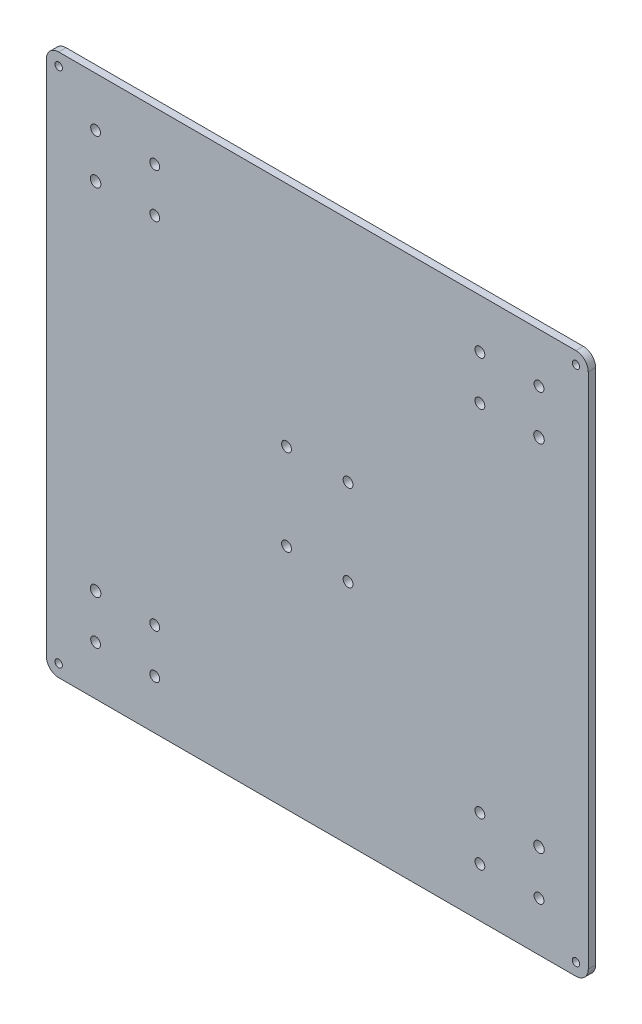
from build123d import *

# Parameters (mm, degrees)
SZKIC1_W                    = 220
SZKIC1_H                    = 220
DODANIE_WYCI_GNI_CIE1_DEPTH = 3
SZKIC2_R                    = 1.5
WYTNIJ_WYCI_GNI_CIE1_DEPTH  = 3
SZKIC3_R                    = 1.5
WYTNIJ_WYCI_GNI_CIE2_DEPTH  = 3
SZKIC4_R                    = 2
WYTNIJ_WYCI_GNI_CIE3_DEPTH  = 3
ZAOKR_GLENIE1_R             = 5
WYTNIJ_WYCI_GNI_CIE4_REACH  = 157.592
SZKIC6_R                    = 2.140240334
SZKIC6_R_2                  = 2
LUSTRO2_COPY_1_REACH        = 157.592
LUSTRO2_COPY_1_SKETCH_R     = 2.140240334
LUSTRO2_COPY_1_SKETCH_R_2   = 2


with BuildPart() as part:
    # Szkic1 → Dodanie-wyciągnięcie1 (new body)
    with BuildSketch(Plane.XY):
        Rectangle(SZKIC1_W, SZKIC1_H)
    extrude(amount=DODANIE_WYCI_GNI_CIE1_DEPTH)

    # Szkic2 → Wytnij-wyciągnięcie1 (cut)
    with BuildSketch(Plane.XY.offset(3)):
        with Locations((105, 105)):
            Circle(SZKIC2_R)
    extrude(amount=-WYTNIJ_WYCI_GNI_CIE1_DEPTH, mode=Mode.SUBTRACT)

    # Szkic3 → Wytnij-wyciągnięcie2 (cut)
    with BuildSketch(Plane.XY.offset(3)):
        with Locations((-105, 105)):
            Circle(SZKIC3_R)
        with Locations((-105, -105)):
            Circle(SZKIC3_R)
        with Locations((105, -105)):
            Circle(SZKIC3_R)
    extrude(amount=-WYTNIJ_WYCI_GNI_CIE2_DEPTH, mode=Mode.SUBTRACT)

    # Szkic4 → Wytnij-wyciągnięcie3 (cut)
    with BuildSketch(Plane.XY.offset(3)):
        with Locations((-12.5, -17.5)):
            Circle(SZKIC4_R)
        with Locations((-12.5, 17.5)):
            Circle(SZKIC4_R)
        with Locations((12.5, 17.5)):
            Circle(SZKIC4_R)
        with Locations((12.5, -17.5)):
            Circle(SZKIC4_R)
    extrude(amount=-WYTNIJ_WYCI_GNI_CIE3_DEPTH, mode=Mode.SUBTRACT)

    # Zaokrąglenie1
    zaokr_glenie1_edges = [part.edges().sort_by_distance(p)[0] for p in [
        (110, -110, 1.5),
        (-110, -110, 1.5),
        (-110, 110, 1.5),
        (110, 110, 1.5),
    ]]
    fillet(zaokr_glenie1_edges, radius=ZAOKR_GLENIE1_R)

    # Szkic6 → Wytnij-wyciągnięcie4 (cut, up to next)
    with BuildSketch(Plane(origin=(0, 0, 0), x_dir=(-1, 0, 0), z_dir=(0, 0, -1)), mode=Mode.PRIVATE) as wytnij_wyci_gni_cie4_sk1:
        with Locations((-90, -72)):
            Circle(SZKIC6_R)
    wytnij_wyci_gni_cie4_tool1 = extrude(wytnij_wyci_gni_cie4_sk1.sketch, amount=-WYTNIJ_WYCI_GNI_CIE4_REACH, mode=Mode.PRIVATE) & part.part
    # Szkic6 → Wytnij-wyciągnięcie4 (cut, up to next)
    with BuildSketch(Plane(origin=(0, 0, 0), x_dir=(-1, 0, 0), z_dir=(0, 0, -1)), mode=Mode.PRIVATE) as wytnij_wyci_gni_cie4_sk2:
        with Locations((-66, -72)):
            Circle(SZKIC6_R_2)
    wytnij_wyci_gni_cie4_tool2 = extrude(wytnij_wyci_gni_cie4_sk2.sketch, amount=-WYTNIJ_WYCI_GNI_CIE4_REACH, mode=Mode.PRIVATE) & part.part
    # Szkic6 → Wytnij-wyciągnięcie4 (cut, up to next)
    with BuildSketch(Plane(origin=(0, 0, 0), x_dir=(-1, 0, 0), z_dir=(0, 0, -1)), mode=Mode.PRIVATE) as wytnij_wyci_gni_cie4_sk3:
        with Locations((-66, -90)):
            Circle(SZKIC6_R_2)
    wytnij_wyci_gni_cie4_tool3 = extrude(wytnij_wyci_gni_cie4_sk3.sketch, amount=-WYTNIJ_WYCI_GNI_CIE4_REACH, mode=Mode.PRIVATE) & part.part
    # Szkic6 → Wytnij-wyciągnięcie4 (cut, up to next)
    with BuildSketch(Plane(origin=(0, 0, 0), x_dir=(-1, 0, 0), z_dir=(0, 0, -1)), mode=Mode.PRIVATE) as wytnij_wyci_gni_cie4_sk4:
        with Locations((-90, -90)):
            Circle(SZKIC6_R_2)
    wytnij_wyci_gni_cie4_tool4 = extrude(wytnij_wyci_gni_cie4_sk4.sketch, amount=-WYTNIJ_WYCI_GNI_CIE4_REACH, mode=Mode.PRIVATE) & part.part
    wytnij_wyci_gni_cie4_1 = wytnij_wyci_gni_cie4_tool1.solids().sort_by_distance((90, -72, 0))[0]
    add(wytnij_wyci_gni_cie4_1, mode=Mode.SUBTRACT)
    wytnij_wyci_gni_cie4_2 = wytnij_wyci_gni_cie4_tool2.solids().sort_by_distance((66, -72, 0))[0]
    add(wytnij_wyci_gni_cie4_2, mode=Mode.SUBTRACT)
    wytnij_wyci_gni_cie4_3 = wytnij_wyci_gni_cie4_tool3.solids().sort_by_distance((66, -90, 0))[0]
    add(wytnij_wyci_gni_cie4_3, mode=Mode.SUBTRACT)
    wytnij_wyci_gni_cie4_4 = wytnij_wyci_gni_cie4_tool4.solids().sort_by_distance((90, -90, 0))[0]
    add(wytnij_wyci_gni_cie4_4, mode=Mode.SUBTRACT)
    wytnij_wyci_gni_cie4 = wytnij_wyci_gni_cie4_1 + wytnij_wyci_gni_cie4_2 + wytnij_wyci_gni_cie4_3 + wytnij_wyci_gni_cie4_4  # Wytnij-wyciągnięcie4 as one shape, for the pattern or mirror that repeats it

    # Lustro1: Wytnij-wyciągnięcie4 across plane
    add(wytnij_wyci_gni_cie4.mirror(Plane(origin=(0, 0, 0), x_dir=(0, 0, 1), z_dir=(1, 0, 0))), mode=Mode.SUBTRACT)

    # Lustro2: Wytnij-wyciągnięcie4 across plane
    add(wytnij_wyci_gni_cie4.mirror(Plane.ZX), mode=Mode.SUBTRACT)

    # Lustro2 copy 1 sketch → Lustro2 copy 1 (cut, up to next)
    with BuildSketch(Plane(origin=(0, 0, 0), x_dir=(1, 0, 0), z_dir=(0, 0, -1)), mode=Mode.PRIVATE) as lustro2_copy_1_sk1:
        with Locations((-90, -72)):
            Circle(LUSTRO2_COPY_1_SKETCH_R)
    lustro2_copy_1_tool1 = extrude(lustro2_copy_1_sk1.sketch, amount=-LUSTRO2_COPY_1_REACH, mode=Mode.PRIVATE) & part.part
    # Lustro2 copy 1 sketch → Lustro2 copy 1 (cut, up to next)
    with BuildSketch(Plane(origin=(0, 0, 0), x_dir=(1, 0, 0), z_dir=(0, 0, -1)), mode=Mode.PRIVATE) as lustro2_copy_1_sk2:
        with Locations((-66, -72)):
            Circle(LUSTRO2_COPY_1_SKETCH_R_2)
    lustro2_copy_1_tool2 = extrude(lustro2_copy_1_sk2.sketch, amount=-LUSTRO2_COPY_1_REACH, mode=Mode.PRIVATE) & part.part
    # Lustro2 copy 1 sketch → Lustro2 copy 1 (cut, up to next)
    with BuildSketch(Plane(origin=(0, 0, 0), x_dir=(1, 0, 0), z_dir=(0, 0, -1)), mode=Mode.PRIVATE) as lustro2_copy_1_sk3:
        with Locations((-66, -90)):
            Circle(LUSTRO2_COPY_1_SKETCH_R_2)
    lustro2_copy_1_tool3 = extrude(lustro2_copy_1_sk3.sketch, amount=-LUSTRO2_COPY_1_REACH, mode=Mode.PRIVATE) & part.part
    # Lustro2 copy 1 sketch → Lustro2 copy 1 (cut, up to next)
    with BuildSketch(Plane(origin=(0, 0, 0), x_dir=(1, 0, 0), z_dir=(0, 0, -1)), mode=Mode.PRIVATE) as lustro2_copy_1_sk4:
        with Locations((-90, -90)):
            Circle(LUSTRO2_COPY_1_SKETCH_R_2)
    lustro2_copy_1_tool4 = extrude(lustro2_copy_1_sk4.sketch, amount=-LUSTRO2_COPY_1_REACH, mode=Mode.PRIVATE) & part.part
    add(lustro2_copy_1_tool1.solids().sort_by_distance((-90, 72, 0))[0], mode=Mode.SUBTRACT)
    add(lustro2_copy_1_tool2.solids().sort_by_distance((-66, 72, 0))[0], mode=Mode.SUBTRACT)
    add(lustro2_copy_1_tool3.solids().sort_by_distance((-66, 90, 0))[0], mode=Mode.SUBTRACT)
    add(lustro2_copy_1_tool4.solids().sort_by_distance((-90, 90, 0))[0], mode=Mode.SUBTRACT)


solid = part.part
